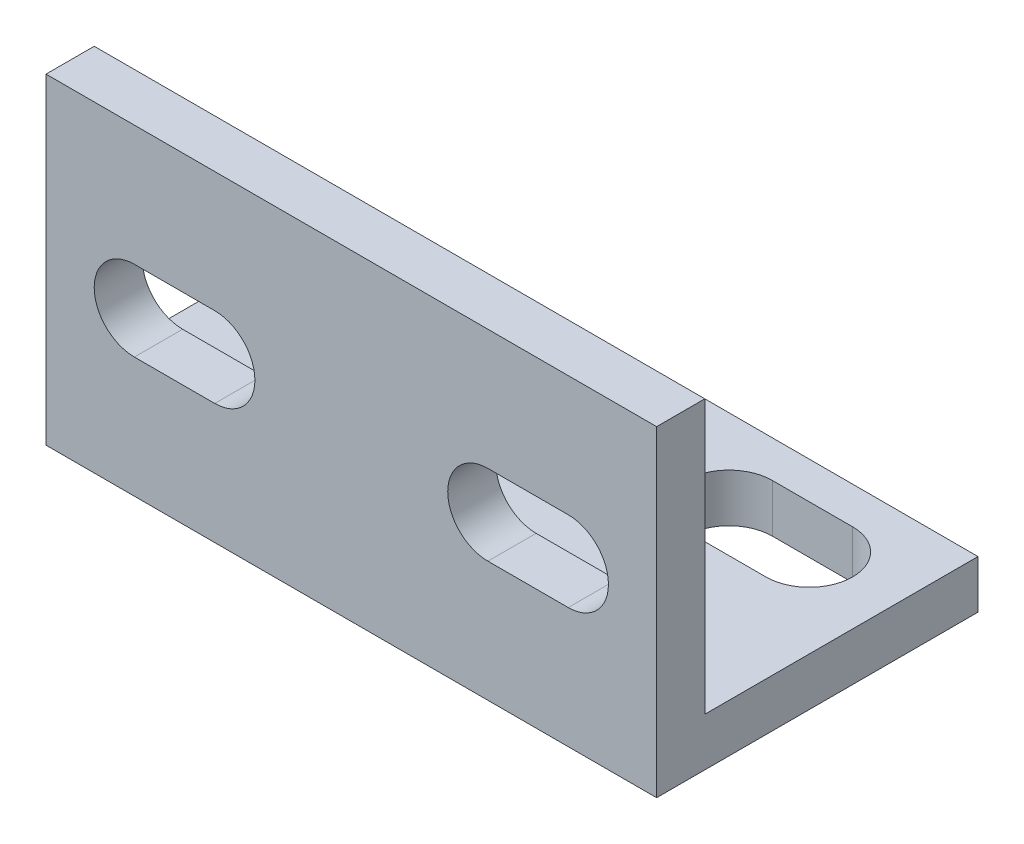
from build123d import *

# Parameters (mm, degrees)
BOSS_EXTRUDE1_DEPTH = 38
CUT_EXTRUDE1_DEPTH  = 4
CUT_EXTRUDE2_DEPTH  = 4


with BuildPart() as part:
    # Sketch1 → Boss-Extrude1 (new body)
    with BuildSketch(Plane(origin=(0, 0, 0), x_dir=(0, 0, -1), z_dir=(1, 0, 0))):
        Polygon((0, 0), (-17, 0), (-17, 17), (-20, 17), (-20, -3), (0, -3), align=None)
    extrude(amount=BOSS_EXTRUDE1_DEPTH)

    # Sketch2 → Cut-Extrude1 (cut)
    with BuildSketch(Plane(origin=(0, 0, 0), x_dir=(1, 0, 0), z_dir=(0, 1, 0))):
        with BuildLine():
            Line((5.5, -2.3), (10.5, -2.3))
            ThreePointArc((10.5, -2.3), (13.2, -5), (10.5, -7.7))
            Line((10.5, -7.7), (5.5, -7.7))
            ThreePointArc((5.5, -7.7), (2.8, -5), (5.5, -2.3))
        make_face()
        with BuildLine():
            Line((32.5, -2.3), (27.5, -2.3))
            ThreePointArc((27.5, -2.3), (24.8, -5), (27.5, -7.7))
            Line((27.5, -7.7), (32.5, -7.7))
            ThreePointArc((32.5, -7.7), (35.2, -5), (32.5, -2.3))
        make_face()
    extrude(amount=-CUT_EXTRUDE1_DEPTH, mode=Mode.SUBTRACT)

    # Sketch3 → Cut-Extrude2 (cut)
    with BuildSketch(Plane(origin=(0, 0, 17), x_dir=(-1, 0, 0), z_dir=(0, 0, -1))):
        with BuildLine():
            Line((-32.5, 9.5), (-27.5, 9.5))
            ThreePointArc((-27.5, 9.5), (-25, 7), (-27.5, 4.5))
            Line((-27.5, 4.5), (-32.5, 4.5))
            ThreePointArc((-32.5, 4.5), (-35, 7), (-32.5, 9.5))
        make_face()
        with BuildLine():
            Line((-5.5, 9.5), (-10.5, 9.5))
            ThreePointArc((-10.5, 9.5), (-13, 7), (-10.5, 4.5))
            Line((-10.5, 4.5), (-5.5, 4.5))
            ThreePointArc((-5.5, 4.5), (-3, 7), (-5.5, 9.5))
        make_face()
    extrude(amount=-CUT_EXTRUDE2_DEPTH, mode=Mode.SUBTRACT)


solid = part.part
